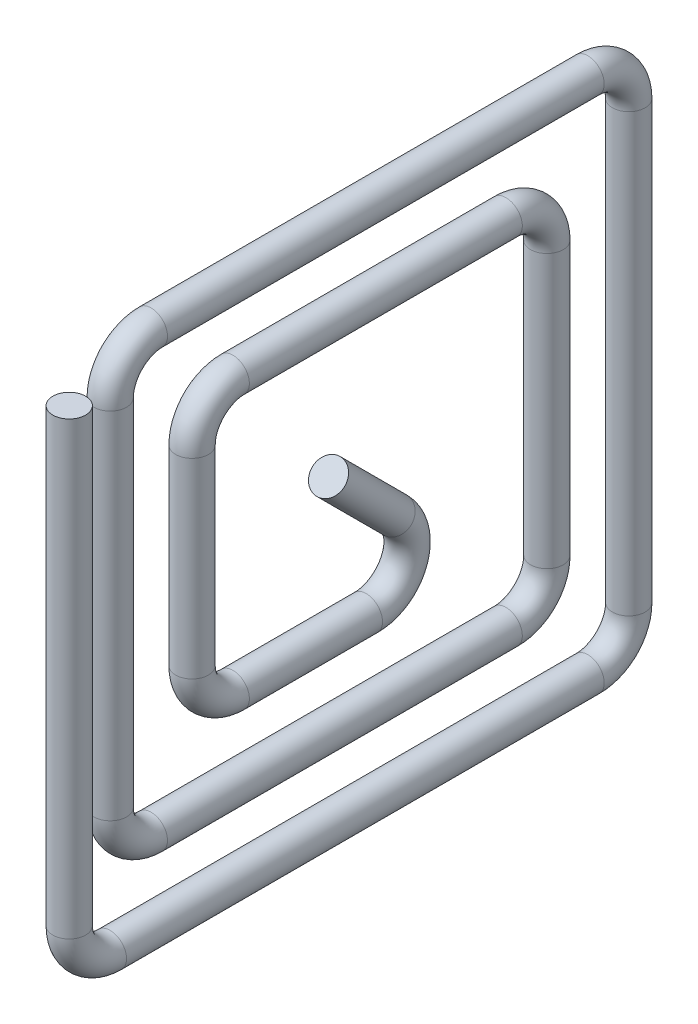
from build123d import *

# Parameters (mm, degrees)
SKETCH_3_R = 0.6


with BuildPart() as part:
    # По траектории1: sweep along a path in Эскиз2
    with BuildLine(Plane(origin=(0, 0, 0), x_dir=(0, 0, -1), z_dir=(1, 0, 0))) as sweep_1_path:
        Line((0, 0), (2.439339828, -2.439339828))
        ThreePointArc((2.439339828, -2.439339828), (2.764498955, -4.074025149), (1.378679656, -5))
        Line((1.378679656, -5), (-3.5, -5))
        ThreePointArc((-3.5, -5), (-4.560660172, -4.560660172), (-5, -3.5))
        Line((-5, -3.5), (-5, 3.5))
        ThreePointArc((-5, 3.5), (-4.560660172, 4.560660172), (-3.5, 5))
        Line((-3.5, 5), (6.5, 5))
        ThreePointArc((6.5, 5), (7.560660172, 4.560660172), (8, 3.5))
        Line((8, 3.5), (8, -6.5))
        ThreePointArc((8, -6.5), (7.560660172, -7.560660172), (6.5, -8))
        Line((6.5, -8), (-6.5, -8))
        ThreePointArc((-6.5, -8), (-7.560660172, -7.560660172), (-8, -6.5))
        Line((-8, -6.5), (-8, 6.5))
        ThreePointArc((-8, 6.5), (-7.560660172, 7.560660172), (-6.5, 8))
        Line((-6.5, 8), (9.5, 8))
        ThreePointArc((9.5, 8), (10.560660172, 7.560660172), (11, 6.5))
        Line((11, 6.5), (11, -9.5))
        ThreePointArc((11, -9.5), (10.560660172, -10.560660172), (9.5, -11))
        Line((9.5, -11), (-8, -11))
        ThreePointArc((-8, -11), (-9.060660172, -10.560660172), (-9.5, -9.5))
        Line((-9.5, -9.5), (-9.5, 7))
    # Эскиз3 → По траектории1 (sweep)
    with BuildSketch(Plane(origin=(0, 7, 9.5), x_dir=(1, 0, 0), z_dir=(0, 1, 0))):
        Circle(SKETCH_3_R)
    sweep(path=sweep_1_path.line)


solid = part.part
